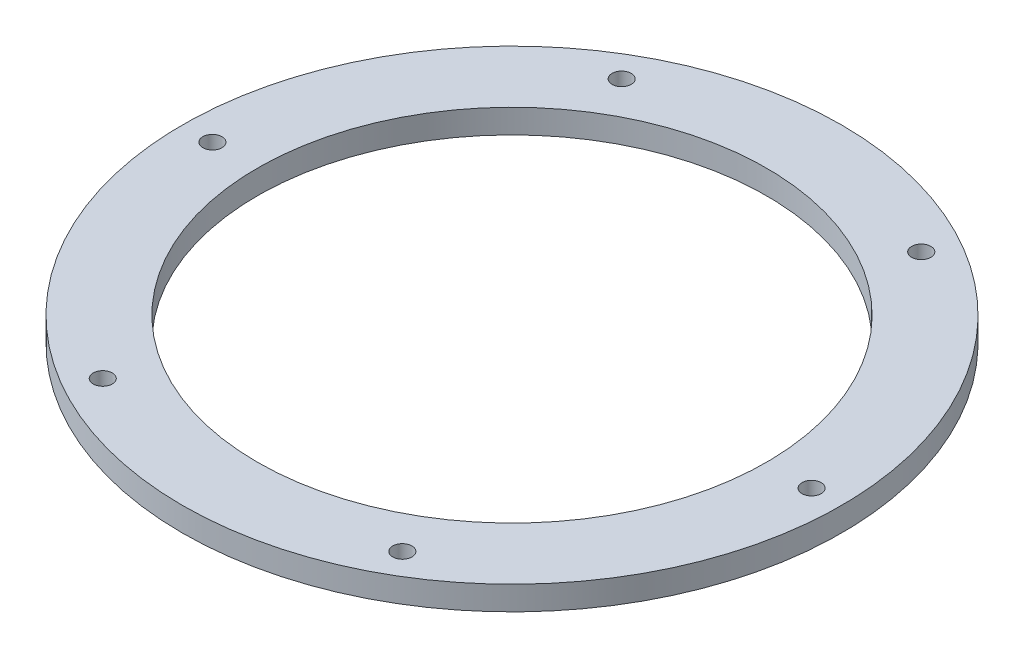
from build123d import *

# Parameters (mm, degrees)
SKETCH_1_R      = 55
SKETCH_1_R_2    = 1.6
SKETCH_1_R_3    = 42.5
EXTRUDE_1_DEPTH = 4


with BuildPart() as part:
    # 草图1 → 凸台-拉伸1 (new body)
    with BuildSketch(Plane(origin=(0, 0, 0), x_dir=(1, 0, 0), z_dir=(0, 1, 0))):
        with Locations(Location((0, 0, 0), (0, 0, 270))):
            Circle(SKETCH_1_R)
        with Locations(Location((25, 43.301270189, 0), (0, 0, 270))):
            Circle(SKETCH_1_R_2, mode=Mode.SUBTRACT)
        with Locations(Location((50, 0, 0), (0, 0, 270))):
            Circle(SKETCH_1_R_2, mode=Mode.SUBTRACT)
        with Locations(Location((25, -43.301270189, 0), (0, 0, 270))):
            Circle(SKETCH_1_R_2, mode=Mode.SUBTRACT)
        with Locations(Location((-25, -43.301270189, 0), (0, 0, 270))):
            Circle(SKETCH_1_R_2, mode=Mode.SUBTRACT)
        with Locations(Location((-50, 0, 0), (0, 0, 270))):
            Circle(SKETCH_1_R_2, mode=Mode.SUBTRACT)
        with Locations(Location((-25, 43.301270189, 0), (0, 0, 270))):
            Circle(SKETCH_1_R_2, mode=Mode.SUBTRACT)
        with Locations(Location((0, 0, 0), (0, 0, 270))):
            Circle(SKETCH_1_R_3, mode=Mode.SUBTRACT)
    extrude(amount=EXTRUDE_1_DEPTH)


solid = part.part
